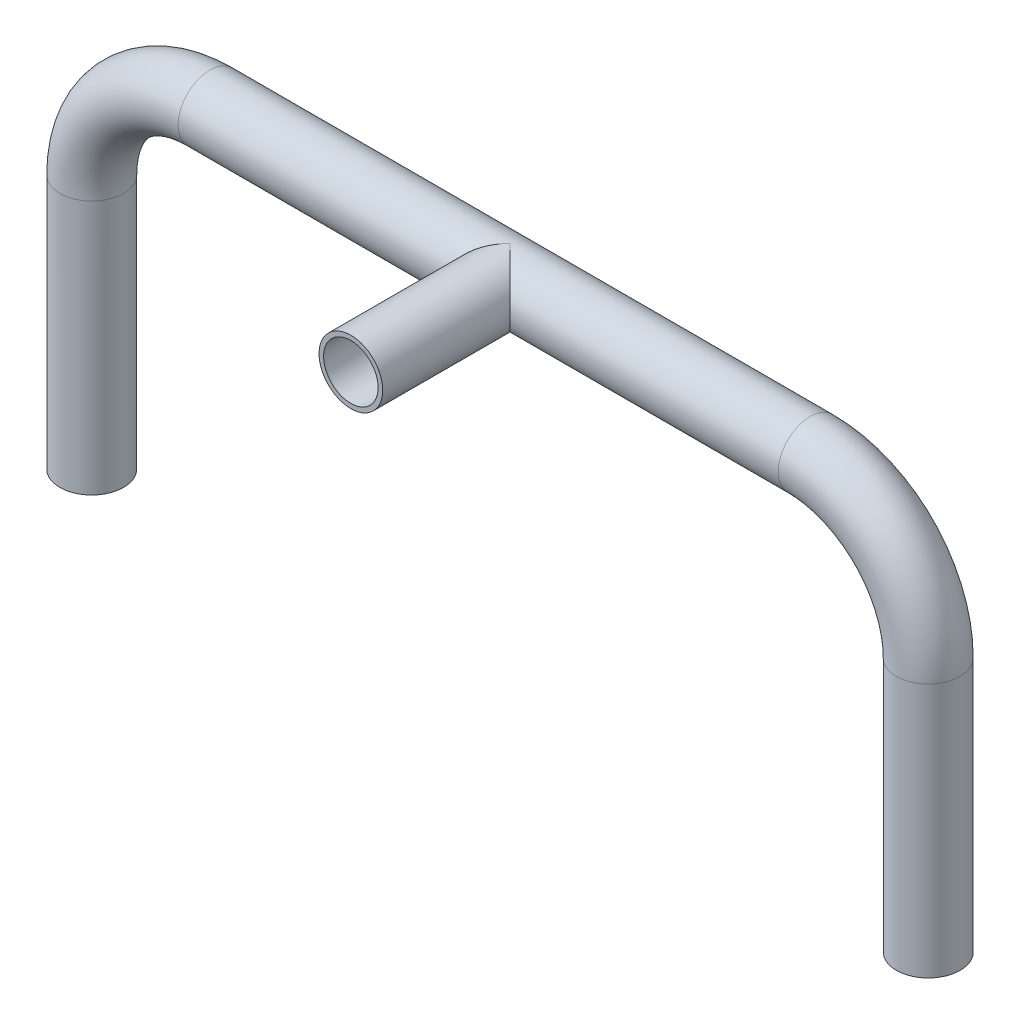
from build123d import *

# Parameters (mm, degrees)
SWEEP_THIN2_PROFILE_R   = 3.5
SWEEP_THIN2_PROFILE_R_2 = 2.5
SKETCH57_R              = 3.5
SKETCH57_R_2            = 3
BOSS_EXTRUDE1_DEPTH     = 17.5


with BuildPart() as part:
    # Sweep-Thin2: sweep along a path in Sketch28
    with BuildLine(Plane.XY) as sweep_thin2_path:
        Line((-46, -41), (-46, -13))
        ThreePointArc((-46, -13), (-42.192388155, -3.807611845), (-33, 0))
        Line((-33, 0), (33, 0))
        ThreePointArc((33, 0), (42.192388155, -3.807611845), (46, -13))
        Line((46, -13), (46, -41))
    # Sweep-Thin2 profile (on start of the path) → Sweep-Thin2 (sweep)
    with BuildSketch(Plane(origin=(-46, -41, 0), x_dir=(1, 0, 0), z_dir=(0, 1, 0))):
        Circle(SWEEP_THIN2_PROFILE_R)
        Circle(SWEEP_THIN2_PROFILE_R_2, mode=Mode.SUBTRACT)
    sweep(path=sweep_thin2_path.line)

    # Sketch57 → Boss-Extrude1 (add)
    with BuildSketch(Plane.XY):
        with Locations(Location((0, 0, 0), (0, 0, 270))):
            Circle(SKETCH57_R)
        with Locations(Location((0, 0, 0), (0, 0, 180))):
            Circle(SKETCH57_R_2, mode=Mode.SUBTRACT)
    extrude(amount=BOSS_EXTRUDE1_DEPTH)


solid = part.part
